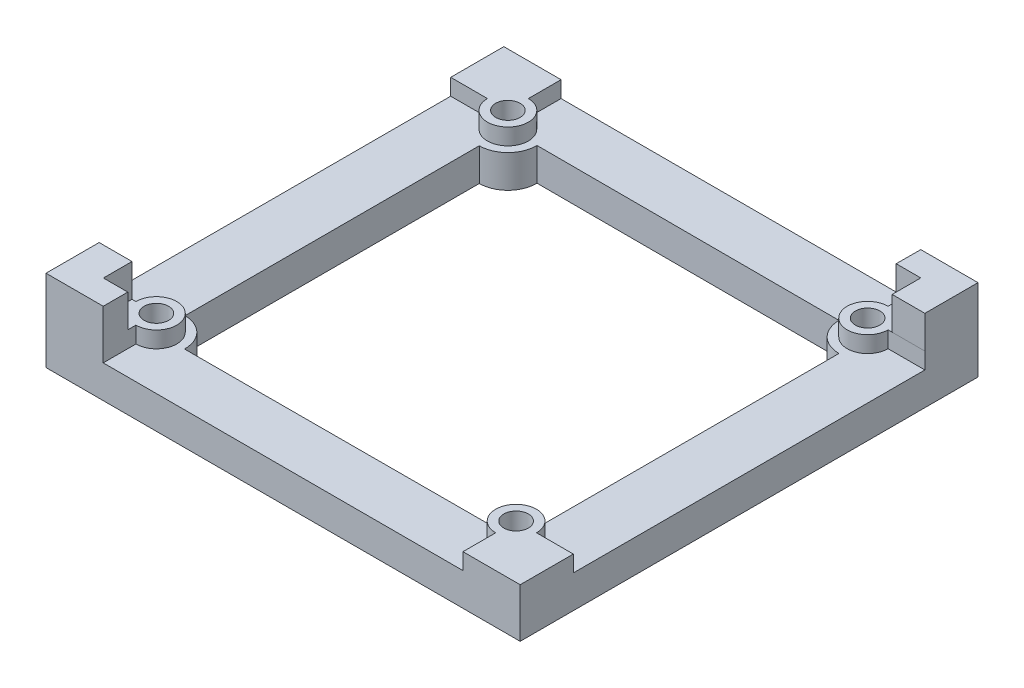
from build123d import *

# Parameters (mm, degrees)
EXTRUDE_1_DEPTH      = 3
EXTRUDE_1_DEPTH_BACK = 53
SKETCH_1_W           = 58
SKETCH_1_H           = 4
SKETCH_2_R           = 1.5
CUT_EXTRUDE_1_DEPTH  = 53
EXTRUDE_START        = 2
SKETCH_3_R           = 2.5
SKETCH_3_R_2         = 1.5
EXTRUDE_2_DEPTH      = 2
CUT_EXTRUDE_2_DEPTH  = 9
EXTRUDE_3_DEPTH      = 2
EXTRUDE_4_DEPTH      = 4


with BuildPart() as part:
    # 草图1 → 凸台-拉伸1 (new, two sides: drawn at the far end of the back side and taken through both)
    with BuildSketch(Plane.XY.offset(-EXTRUDE_1_DEPTH_BACK)):
        with Locations((0, -2)):
            Rectangle(SKETCH_1_W, SKETCH_1_H)
    extrude(amount=EXTRUDE_1_DEPTH + EXTRUDE_1_DEPTH_BACK)

    # 草图2 → 切除-拉伸1 (cut)
    with BuildSketch(Plane(origin=(0, 0, 0), x_dir=(1, 0, 0), z_dir=(0, 1, 0))):
        with Locations(Location((-22, 46.5, 0), (0, 0, 180))):
            Circle(SKETCH_2_R)
        with Locations(Location((22, 46.5, 0), (0, 0, 180))):
            Circle(SKETCH_2_R)
        with Locations(Location((22, 3.5, 0), (0, 0, 180))):
            Circle(SKETCH_2_R)
        with Locations(Location((-22, 3.5, 0), (0, 0, 180))):
            Circle(SKETCH_2_R)
    extrude(amount=-CUT_EXTRUDE_1_DEPTH, mode=Mode.SUBTRACT)

    # 草图3 → 凸台-拉伸2 (add)
    # profile 1 of 4: a face of its own
    with BuildSketch(Plane(origin=(0, 0, 0), x_dir=(1, 0, 0), z_dir=(0, 1, 0)).offset(EXTRUDE_START)):
        with Locations((-22, 46.5)):
            Circle(SKETCH_3_R)
        with Locations(Location((-22, 46.5, 0), (0, 0, 180))):
            Circle(SKETCH_3_R_2, mode=Mode.SUBTRACT)
    # profile 2 of 4: a face of its own
    with BuildSketch(Plane(origin=(0, 0, 0), x_dir=(1, 0, 0), z_dir=(0, 1, 0)).offset(EXTRUDE_START)):
        with Locations((22, 46.5)):
            Circle(SKETCH_3_R)
        with Locations(Location((22, 46.5, 0), (0, 0, 180))):
            Circle(SKETCH_3_R_2, mode=Mode.SUBTRACT)
    # profile 3 of 4: a face of its own
    with BuildSketch(Plane(origin=(0, 0, 0), x_dir=(1, 0, 0), z_dir=(0, 1, 0)).offset(EXTRUDE_START)):
        with Locations((22, 3.5)):
            Circle(SKETCH_3_R)
        with Locations(Location((22, 3.5, 0), (0, 0, 180))):
            Circle(SKETCH_3_R_2, mode=Mode.SUBTRACT)
    # profile 4 of 4: a face of its own
    with BuildSketch(Plane(origin=(0, 0, 0), x_dir=(1, 0, 0), z_dir=(0, 1, 0)).offset(EXTRUDE_START)):
        with Locations((-22, 3.5)):
            Circle(SKETCH_3_R)
        with Locations(Location((-22, 3.5, 0), (0, 0, 180))):
            Circle(SKETCH_3_R_2, mode=Mode.SUBTRACT)
    extrude(amount=-EXTRUDE_2_DEPTH)

    # 草图4 → 切除-拉伸2 (cut)
    with BuildSketch(Plane(origin=(0, 0, 0), x_dir=(1, 0, 0), z_dir=(0, 1, 0))):
        with BuildLine():
            Line((-18.5, 46.56), (18.5, 46.5))
            ThreePointArc((18.5, 46.5), (19.525126266, 44.025126266), (22, 43))
            Line((22, 43), (22, 7))
            ThreePointArc((22, 7), (19.525126266, 5.974873734), (18.5, 3.5))
            Line((18.5, 3.5), (-18.5, 3.44))
            ThreePointArc((-18.5, 3.44), (-19.503639564, 5.953932471), (-22, 7.000514248))
            Line((-22, 7.000514248), (-22, 42.999485752))
            ThreePointArc((-22, 42.999485752), (-19.503639564, 44.046067529), (-18.5, 46.56))
        make_face()
    extrude(amount=-CUT_EXTRUDE_2_DEPTH, mode=Mode.SUBTRACT)

    # 草图5 → 凸台-拉伸3 (add)
    with BuildSketch(Plane(origin=(0, 0, 0), x_dir=(1, 0, 0), z_dir=(0, 1, 0))):
        Polygon((-22, 49), (-22, 53), (-29, 53), (-29, 46.5), (-24.5, 46.5), align=None)
        Polygon((22, 49), (22, 53), (29, 53), (29, 46.5), (24.5, 46.5), align=None)
        Polygon((24.5, 3.5), (29, 3.5), (29, -3), (22, -3), (22, 1), align=None)
        Polygon((-24.5, 3.5), (-29, 3.5), (-29, -3), (-22, -3), (-22, 1), align=None)
    extrude(amount=EXTRUDE_3_DEPTH)

    # 草图6 → 凸台-拉伸4 (add)
    with BuildSketch(Plane(origin=(0, 2, 0), x_dir=(1, 0, 0), z_dir=(0, 1, 0))):
        Polygon((-24.979953432, 3.5), (-24.979953432, 0), (-22, 0), (-22, -3), (-29, -3), (-29, 3.5), align=None)
        Polygon((21.985616423, 50), (25, 50), (25, 46.500843785), (29, 46.5), (29, 53), (22, 53), align=None)
    extrude(amount=EXTRUDE_4_DEPTH)


solid = part.part
